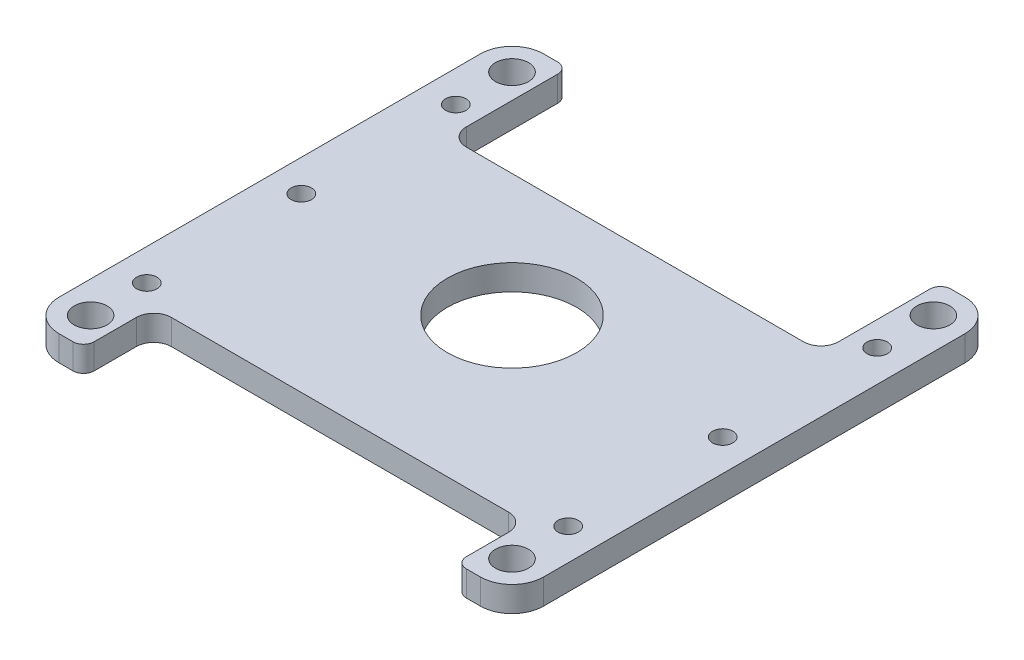
from build123d import *

# Parameters (mm, degrees)
SKETCH1_W           = 70
SKETCH1_H           = 70
BOSS_EXTRUDE1_DEPTH = 3.6
SKETCH2_W           = 87.76827376
SKETCH2_H           = 85.716468358
CUT_EXTRUDE1_DEPTH  = 10
SKETCH4_R           = 2.35
SKETCH4_R_2         = 1.45
SKETCH4_R_3         = 9.2
CUT_EXTRUDE2_DEPTH  = 10


with BuildPart() as part:
    # Sketch1 → Boss-Extrude1 (new body)
    with BuildSketch(Plane(origin=(0, 0, 0), x_dir=(1, 0, 0), z_dir=(0, 1, 0))):
        Rectangle(SKETCH1_W, SKETCH1_H)
    extrude(amount=BOSS_EXTRUDE1_DEPTH)

    # Sketch2 → Cut-Extrude1 (cut)
    with BuildSketch(Plane(origin=(0, 3.6, 0), x_dir=(1, 0, 0), z_dir=(0, 1, 0))):
        Rectangle(SKETCH2_W, SKETCH2_H)
        with BuildLine():
            Line((30, 34.5), (28, 34.5))
            ThreePointArc((28, 34.5), (26.939339828, 34.060660172), (26.5, 33))
            Line((26.5, 33), (26.5, 20))
            ThreePointArc((26.5, 20), (25.767766953, 18.232233047), (24, 17.5))
            Line((24, 17.5), (-24, 17.5))
            ThreePointArc((-24, 17.5), (-25.767766953, 18.232233047), (-26.5, 20))
            Line((-26.5, 20), (-26.5, 33))
            ThreePointArc((-26.5, 33), (-26.939339828, 34.060660172), (-28, 34.5))
            Line((-28, 34.5), (-30, 34.5))
            ThreePointArc((-30, 34.5), (-33.181980515, 33.181980515), (-34.5, 30))
            Line((-34.5, 30), (-34.5, -30))
            ThreePointArc((-34.5, -30), (-33.181980515, -33.181980515), (-30, -34.5))
            Line((-30, -34.5), (-28, -34.5))
            ThreePointArc((-28, -34.5), (-26.939339828, -34.060660172), (-26.5, -33))
            Line((-26.5, -33), (-26.5, -27))
            ThreePointArc((-26.5, -27), (-25.767766953, -25.232233047), (-24, -24.5))
            Line((-24, -24.5), (24, -24.5))
            ThreePointArc((24, -24.5), (25.767766953, -25.232233047), (26.5, -27))
            Line((26.5, -27), (26.5, -33))
            ThreePointArc((26.5, -33), (26.939339828, -34.060660172), (28, -34.5))
            Line((28, -34.5), (30, -34.5))
            ThreePointArc((30, -34.5), (33.181980515, -33.181980515), (34.5, -30))
            Line((34.5, -30), (34.5, 30))
            ThreePointArc((34.5, 30), (33.181980515, 33.181980515), (30, 34.5))
        make_face(mode=Mode.SUBTRACT)
    extrude(amount=-CUT_EXTRUDE1_DEPTH, mode=Mode.SUBTRACT)

    # Sketch4 → Cut-Extrude2 (cut)
    with BuildSketch(Plane.XZ):
        with Locations(Location((30, -30, 0), (0, 0, 270))):
            Circle(SKETCH4_R)
        with Locations(Location((30, -22, 0), (0, 0, 270))):
            Circle(SKETCH4_R_2)
        with Locations(Location((30, 0, 0), (0, 0, 270))):
            Circle(SKETCH4_R_2)
        with Locations(Location((30, 22, 0), (0, 0, 270))):
            Circle(SKETCH4_R_2)
        with Locations(Location((30, 30, 0), (0, 0, 270))):
            Circle(SKETCH4_R)
        with Locations(Location((-30, -30, 0), (0, 0, 270))):
            Circle(SKETCH4_R)
        with Locations(Location((-30, -22, 0), (0, 0, 270))):
            Circle(SKETCH4_R_2)
        with Locations(Location((0, 0, 0), (0, 0, 270))):
            Circle(SKETCH4_R_3)
        with Locations(Location((-30, 0, 0), (0, 0, 270))):
            Circle(SKETCH4_R_2)
        with Locations(Location((-30, 22, 0), (0, 0, 270))):
            Circle(SKETCH4_R_2)
        with Locations(Location((-30, 30, 0), (0, 0, 270))):
            Circle(SKETCH4_R)
    extrude(amount=-CUT_EXTRUDE2_DEPTH, mode=Mode.SUBTRACT)


solid = part.part
